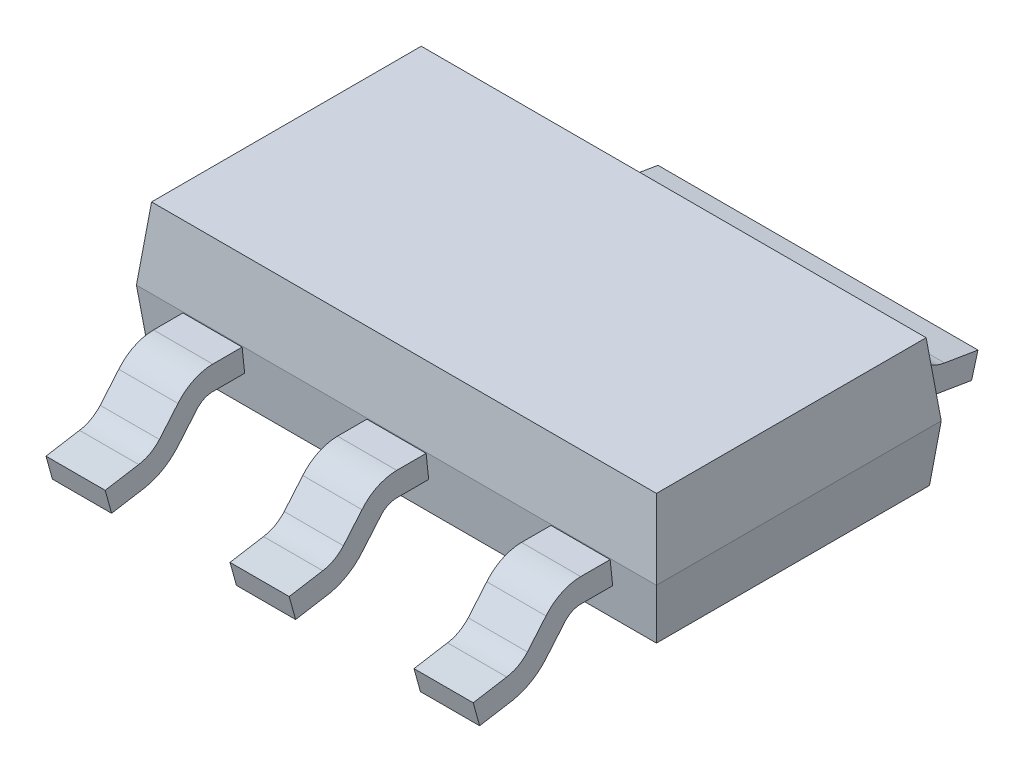
from build123d import *

# Parameters (mm, degrees)
ESBO_O1_W                 = 6.5
ESBO_O1_H                 = 3.56
EXTRUS_O1_DEPTH           = 0.9
EXTRUS_O1_TAPER           = 6
EXTRUS_O1_OTHER_WAY_DEPTH = 0.7
EXTRUS_O1_OTHER_WAY_TAPER = 6
ESBO_O3_W                 = 0.74
ESBO_O3_H                 = 0.3
PADR_O_LINEAR1_COUNT      = 2
PADR_O_LINEAR1_PITCH      = 2.3
PADR_O_LINEAR1_COL_COUNT  = 2
PADR_O_LINEAR1_COL_PITCH  = 2.3
ESBO_O5_W                 = 4
ESBO_O5_H                 = 0.3


with BuildPart() as part:
    # Esboço1 → Extrusão1 (new body)
    with BuildSketch(Plane(origin=(0, 0, 0), x_dir=(1, 0, 0), z_dir=(0, 1, 0))):
        Rectangle(ESBO_O1_W, ESBO_O1_H)
    extrude(amount=EXTRUS_O1_DEPTH, taper=EXTRUS_O1_TAPER)

    # Esboço1 → Extrusão1 other way (add)
    with BuildSketch(Plane(origin=(0, 0, 0), x_dir=(1, 0, 0), z_dir=(0, 1, 0))):
        Rectangle(ESBO_O1_W, ESBO_O1_H)
    extrude(amount=-EXTRUS_O1_OTHER_WAY_DEPTH, taper=EXTRUS_O1_OTHER_WAY_TAPER)

    # Varredura1: sweep along a path in Esboço2
    with BuildLine(Plane(origin=(0, 0, 0), x_dir=(0, 0, -1), z_dir=(1, 0, 0))) as varredura1_path:
        Line((-1.771086264, -0.084808537), (-2.138904869, -0.084808537))
        ThreePointArc((-2.138904869, -0.084808537), (-2.349489276, -0.131317404), (-2.520897515, -0.262191707))
        Line((-2.520897515, -0.262191707), (-2.752531862, -0.536457055))
        ThreePointArc((-2.752531862, -0.536457055), (-2.88725344, -0.648417053), (-3.052325014, -0.707037188))
        Line((-3.052325014, -0.707037188), (-3.471086264, -0.776830729))
    # Esboço3 → Varredura1 (sweep)
    with BuildSketch(Plane(origin=(0, -0.185041405, 1.760551365), x_dir=(1, 0, 0), z_dir=(0, -0.1045284632676535, 0.9945218953682734))):
        with Locations((0, 0.023347308)):
            Rectangle(ESBO_O3_W, ESBO_O3_H)
    varredura1 = sweep(path=varredura1_path.line)

    # Padrão linear1: Varredura1 ×2
    with Locations(*[(i * PADR_O_LINEAR1_PITCH, 0, 0) for i in range(1, PADR_O_LINEAR1_COUNT)]):
        add(varredura1)

    # Padrão linear1 col: Varredura1 ×2
    with Locations(*[(-i * PADR_O_LINEAR1_COL_PITCH, 0, 0) for i in range(1, PADR_O_LINEAR1_COL_COUNT)]):
        add(varredura1)

    # Varredura2: sweep along a path in Esboço4
    with BuildLine(Plane(origin=(0, 0, 0), x_dir=(0, 0, -1), z_dir=(1, 0, 0))) as varredura2_path:
        Line((1.770334988, -0.091956448), (2.13866613, -0.091956448))
        ThreePointArc((2.13866613, -0.091956448), (2.34886791, -0.138287834), (2.52011393, -0.2686956))
        Line((2.52011393, -0.2686956), (2.751853347, -0.542148112))
        ThreePointArc((2.751853347, -0.542148112), (2.886396765, -0.653672528), (3.051101653, -0.712084226))
        Line((3.051101653, -0.712084226), (3.470334988, -0.781956448))
    # Esboço5 → Varredura2 (sweep)
    with BuildSketch(Plane(origin=(0, -0.185041405, -1.760551365), x_dir=(-1, 0, 0), z_dir=(0, -0.1045284632676535, -0.9945218953682734))):
        with Locations((0, 0.014790466)):
            Rectangle(ESBO_O5_W, ESBO_O5_H)
    sweep(path=varredura2_path.line)


solid = part.part
